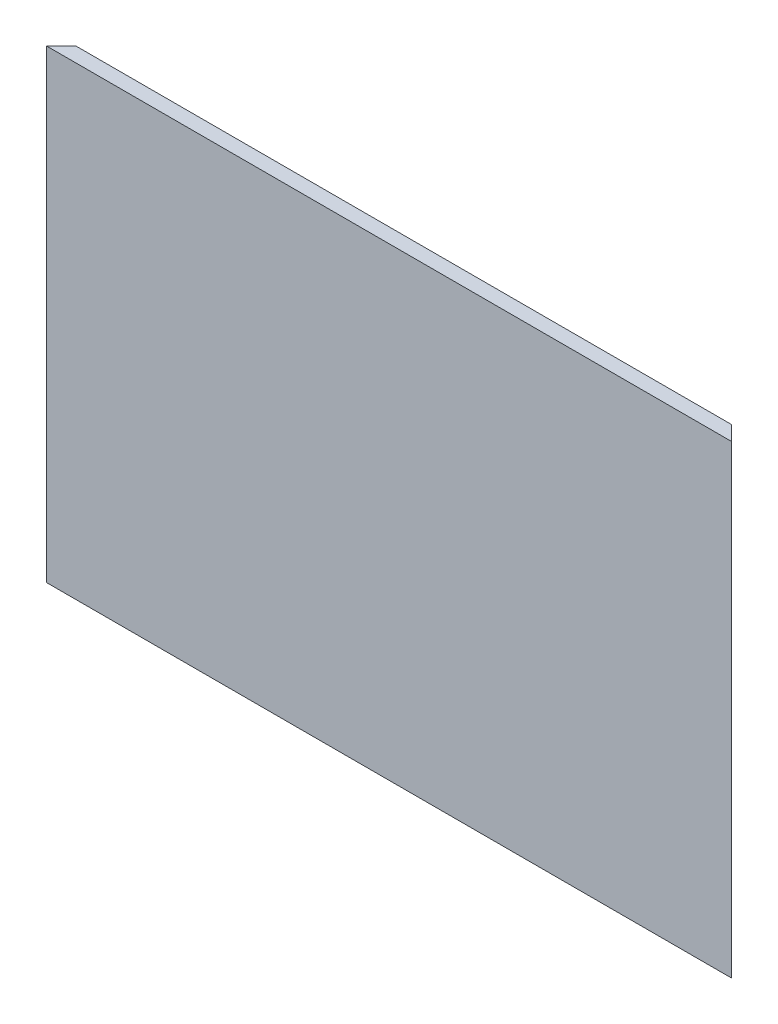
from build123d import *

# Parameters (mm, degrees)
SKETCH1_W           = 140
SKETCH1_H           = 3
BOSS_EXTRUDE1_DEPTH = 95
CUT_EXTRUDE1_DEPTH  = 95


with BuildPart() as part:
    # Sketch1 → Boss-Extrude1 (new body)
    with BuildSketch(Plane(origin=(0, 0, 0), x_dir=(1, 0, 0), z_dir=(0, 1, 0))):
        Rectangle(SKETCH1_W, SKETCH1_H)
    extrude(amount=BOSS_EXTRUDE1_DEPTH)

    # Sketch2 → Cut-Extrude1 (cut)
    with BuildSketch(Plane(origin=(0, 95, 0), x_dir=(1, 0, 0), z_dir=(0, 1, 0))):
        Polygon((70, -1.5), (70, 1.5), (67, 1.5), align=None)
        Polygon((-70, -1.5), (-70, 1.5), (-67, 1.5), align=None)
    extrude(amount=-CUT_EXTRUDE1_DEPTH, mode=Mode.SUBTRACT)


solid = part.part
